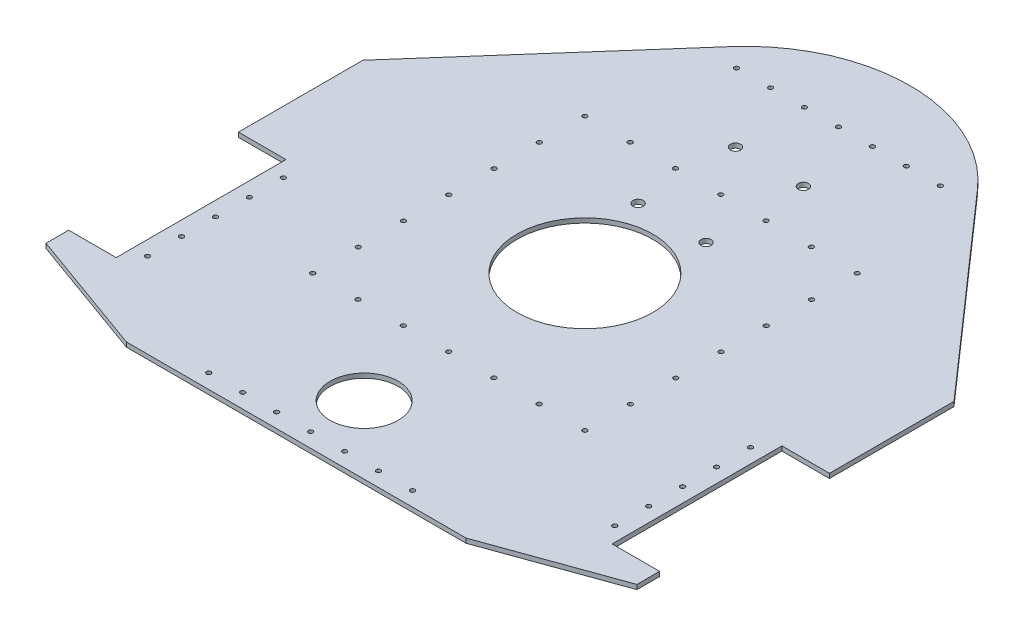
from build123d import *

# Parameters (mm, degrees)
BOSS_EXTRUDE1_DEPTH = 4
SKETCH2_R           = 2
CUT_EXTRUDE1_DEPTH  = 4
SKETCH4_R           = 30
SKETCH4_R_2         = 2
SKETCH4_R_3         = 60
CUT_EXTRUDE2_DEPTH  = 4
SKETCH5_R           = 4.5
CUT_EXTRUDE3_DEPTH  = 4
SKETCH6_R           = 2
CUT_EXTRUDE4_DEPTH  = 4


with BuildPart() as part:
    # Sketch1 → Boss-Extrude1 (new body)
    with BuildSketch(Plane(origin=(0, 0, 0), x_dir=(1, 0, 0), z_dir=(0, 1, 0))):
        with BuildLine():
            Line((-219, 50), (-219, -100))
            Line((-219, -100), (-261, -100))
            Line((-261, -100), (-261, -120))
            Line((-261, -120), (-150, -160))
            Line((-150, -160), (150, -160))
            Line((150, -160), (261, -120))
            Line((261, -120), (261, -100))
            Line((261, -100), (219, -100))
            Line((219, -100), (219, 50))
            Line((219, 50), (261, 50))
            Line((261, 50), (261, 160))
            Line((261, 160), (110, 331.658711753))
            ThreePointArc((110, 331.658711753), (0, 382.155640476), (-110, 331.658711753))
            Line((-110, 331.658711753), (-261, 160))
            Line((-261, 160), (-261, 50))
            Line((-261, 50), (-219, 50))
        make_face()
    extrude(amount=BOSS_EXTRUDE1_DEPTH)

    # Sketch2 → Cut-Extrude1 (cut)
    with BuildSketch(Plane(origin=(0, 4, 0), x_dir=(1, 0, 0), z_dir=(0, 1, 0))):
        with Locations(Location((-206.3, -25, 0), (0, 0, 270))):
            Circle(SKETCH2_R)
        with Locations(Location((-206.3, 5, 0), (0, 0, 270))):
            Circle(SKETCH2_R)
        with Locations(Location((-206.3, 35, 0), (0, 0, 270))):
            Circle(SKETCH2_R)
        with Locations(Location((-206.3, -55, 0), (0, 0, 270))):
            Circle(SKETCH2_R)
        with Locations(Location((-206.3, -85, 0), (0, 0, 270))):
            Circle(SKETCH2_R)
        with Locations(Location((206.3, -85, 0), (0, 0, 270))):
            Circle(SKETCH2_R)
        with Locations(Location((206.3, -55, 0), (0, 0, 270))):
            Circle(SKETCH2_R)
        with Locations(Location((206.3, -25, 0), (0, 0, 270))):
            Circle(SKETCH2_R)
        with Locations(Location((206.3, 5, 0), (0, 0, 270))):
            Circle(SKETCH2_R)
        with Locations(Location((206.3, 35, 0), (0, 0, 270))):
            Circle(SKETCH2_R)
    extrude(amount=-CUT_EXTRUDE1_DEPTH, mode=Mode.SUBTRACT)

    # Sketch4 → Cut-Extrude2 (cut)
    with BuildSketch(Plane(origin=(0, 4, 0), x_dir=(1, 0, 0), z_dir=(0, 1, 0))):
        with Locations(Location((0, -100, 0), (0, 0, 270))):
            Circle(SKETCH4_R)
        with Locations(Location((-120.208152802, 215.208152802, 0), (0, 0, 270))):
            Circle(SKETCH4_R_2)
        with Locations(Location((0, 95, 0), (0, 0, 270))):
            Circle(SKETCH4_R_3)
        with Locations(Location((120.208152802, 215.208152802, 0), (0, 0, 270))):
            Circle(SKETCH4_R_2)
        with Locations(Location((120.208152802, -25.208152802, 0), (0, 0, 270))):
            Circle(SKETCH4_R_2)
        with Locations(Location((-120.208152802, -25.208152802, 0), (0, 0, 270))):
            Circle(SKETCH4_R_2)
        with Locations(Location((-120.208152802, 95, 0), (0, 0, 270))):
            Circle(SKETCH4_R_2)
        with Locations(Location((-120.208152802, 135, 0), (0, 0, 270))):
            Circle(SKETCH4_R_2)
        with Locations(Location((-120.208152802, 175, 0), (0, 0, 270))):
            Circle(SKETCH4_R_2)
        with Locations(Location((-120.208152802, 55, 0), (0, 0, 270))):
            Circle(SKETCH4_R_2)
        with Locations(Location((-120.208152802, 15, 0), (0, 0, 270))):
            Circle(SKETCH4_R_2)
        with Locations(Location((120.208152802, 15, 0), (0, 0, 270))):
            Circle(SKETCH4_R_2)
        with Locations(Location((120.208152802, 55, 0), (0, 0, 270))):
            Circle(SKETCH4_R_2)
        with Locations(Location((120.208152802, 95, 0), (0, 0, 270))):
            Circle(SKETCH4_R_2)
        with Locations(Location((120.208152802, 135, 0), (0, 0, 270))):
            Circle(SKETCH4_R_2)
        with Locations(Location((120.208152802, 175, 0), (0, 0, 270))):
            Circle(SKETCH4_R_2)
        with Locations(Location((-80.208152802, 215.208152802, 0), (0, 0, 270))):
            Circle(SKETCH4_R_2)
        with Locations(Location((-80.208152802, -25.208152802, 0), (0, 0, 270))):
            Circle(SKETCH4_R_2)
        with Locations(Location((-40.208152802, 215.208152802, 0), (0, 0, 270))):
            Circle(SKETCH4_R_2)
        with Locations(Location((-40.208152802, -25.208152802, 0), (0, 0, 270))):
            Circle(SKETCH4_R_2)
        with Locations(Location((-0.208152802, 215.208152802, 0), (0, 0, 270))):
            Circle(SKETCH4_R_2)
        with Locations(Location((-0.208152802, -25.208152802, 0), (0, 0, 270))):
            Circle(SKETCH4_R_2)
        with Locations(Location((39.791847198, 215.208152802, 0), (0, 0, 270))):
            Circle(SKETCH4_R_2)
        with Locations(Location((39.791847198, -25.208152802, 0), (0, 0, 270))):
            Circle(SKETCH4_R_2)
        with Locations(Location((79.791847198, 215.208152802, 0), (0, 0, 270))):
            Circle(SKETCH4_R_2)
        with Locations(Location((79.791847198, -25.208152802, 0), (0, 0, 270))):
            Circle(SKETCH4_R_2)
    extrude(amount=-CUT_EXTRUDE2_DEPTH, mode=Mode.SUBTRACT)

    # Sketch5 → Cut-Extrude3 (cut)
    with BuildSketch(Plane(origin=(0, 4, 0), x_dir=(1, 0, 0), z_dir=(0, 1, 0))):
        with Locations(Location((-30, 172, 0), (0, 0, 270))):
            Circle(SKETCH5_R)
        with Locations(Location((30, 172, 0), (0, 0, 270))):
            Circle(SKETCH5_R)
        with Locations(Location((30, 258, 0), (0, 0, 270))):
            Circle(SKETCH5_R)
        with Locations(Location((-30, 258, 0), (0, 0, 270))):
            Circle(SKETCH5_R)
    extrude(amount=-CUT_EXTRUDE3_DEPTH, mode=Mode.SUBTRACT)

    # Sketch6 → Cut-Extrude4 (cut)
    with BuildSketch(Plane(origin=(0, 4, 0), x_dir=(1, 0, 0), z_dir=(0, 1, 0))):
        with Locations(Location((0, 318.958711753, 0), (0, 0, 270))):
            Circle(SKETCH6_R)
        with Locations(Location((30, 318.958711753, 0), (0, 0, 270))):
            Circle(SKETCH6_R)
        with Locations(Location((60, 318.958711753, 0), (0, 0, 270))):
            Circle(SKETCH6_R)
        with Locations(Location((90, 318.958711753, 0), (0, 0, 270))):
            Circle(SKETCH6_R)
        with Locations(Location((-30, 318.958711753, 0), (0, 0, 270))):
            Circle(SKETCH6_R)
        with Locations(Location((-60, 318.958711753, 0), (0, 0, 270))):
            Circle(SKETCH6_R)
        with Locations(Location((-90, 318.958711753, 0), (0, 0, 270))):
            Circle(SKETCH6_R)
        with Locations(Location((0, -147.3, 0), (0, 0, 270))):
            Circle(SKETCH6_R)
        with Locations(Location((30, -147.3, 0), (0, 0, 270))):
            Circle(SKETCH6_R)
        with Locations(Location((60, -147.3, 0), (0, 0, 270))):
            Circle(SKETCH6_R)
        with Locations(Location((90, -147.3, 0), (0, 0, 270))):
            Circle(SKETCH6_R)
        with Locations(Location((-30, -147.3, 0), (0, 0, 270))):
            Circle(SKETCH6_R)
        with Locations(Location((-60, -147.3, 0), (0, 0, 270))):
            Circle(SKETCH6_R)
        with Locations(Location((-90, -147.3, 0), (0, 0, 270))):
            Circle(SKETCH6_R)
    extrude(amount=-CUT_EXTRUDE4_DEPTH, mode=Mode.SUBTRACT)


solid = part.part
